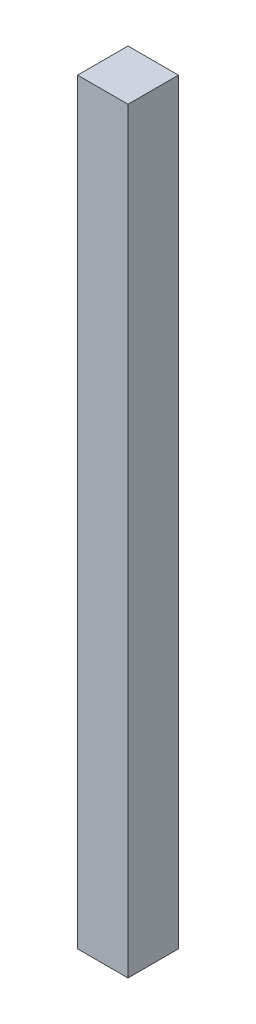
from build123d import *

# Parameters (mm, degrees)
SKIZZE2_W                       = 20
SKIZZE2_H                       = 20
AUFSATZ_LINEAR_AUSTRAGEN1_DEPTH = 300


with BuildPart() as part:
    # Skizze2 → Aufsatz-Linear austragen1 (new body)
    with BuildSketch(Plane(origin=(0, 0, 0), x_dir=(1, 0, 0), z_dir=(0, 1, 0))):
        Rectangle(SKIZZE2_W, SKIZZE2_H)
    extrude(amount=AUFSATZ_LINEAR_AUSTRAGEN1_DEPTH)


solid = part.part
